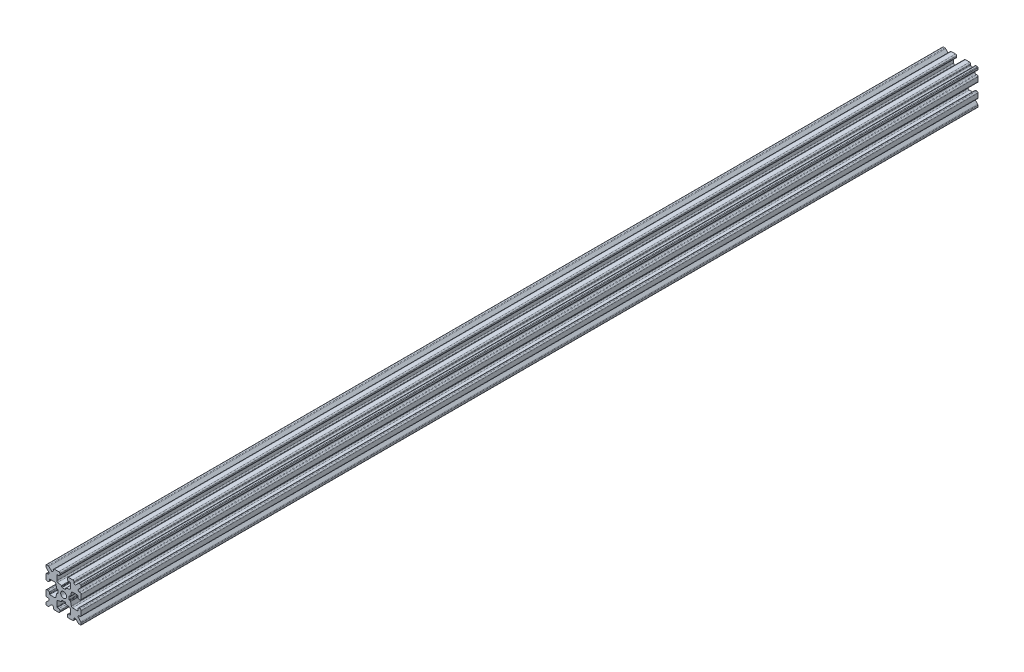
from build123d import *

# Parameters (mm, degrees)
SKETCH1_W           = 15
SKETCH1_H           = 15
SKETCH1_R           = 1.25
BOSS_EXTRUDE1_DEPTH = 191
FILLET1_R           = 0.25
CUT_EXTRUDE1_DEPTH  = 383.147222939
CUT_EXTRUDE3_DEPTH  = 383.147222939
FILLET3_R           = 0.5
FILLET4_R           = 0.5
FILLET5_R           = 3
FILLET6_R           = 0.2
CUT_EXTRUDE4_DEPTH  = 383.147222939
FILLET8_R           = 0.5
SKETCH6_W           = 5.1529354
SKETCH6_H           = 1.651
SKETCH6_W_2         = 1.651
SKETCH6_H_2         = 5.1529354
CUT_EXTRUDE5_DEPTH  = 383.147222939
FILLET10_R          = 0.2


with BuildPart() as part:
    # Sketch1 → Boss-Extrude1 (new, symmetric)
    with BuildSketch(Plane.XY):
        Rectangle(SKETCH1_W, SKETCH1_H)
        Circle(SKETCH1_R, mode=Mode.SUBTRACT)
    extrude(amount=BOSS_EXTRUDE1_DEPTH, both=True)

    # Fillet1
    fillet1_edges = [part.edges().sort_by_distance(p)[0] for p in [
        (7.5, -7.5, 0),
        (-7.5, -7.5, 0),
        (-7.5, 7.5, 0),
        (7.5, 7.5, 0),
    ]]
    fillet(fillet1_edges, radius=FILLET1_R)

    # Sketch2 → Cut-Extrude1 (cut, through all)
    with BuildSketch(Plane.XY.offset(191)):
        Polygon((-7.5, 1.6), (-6.1, 1.6), (-6.1, 2.9), (-3.4, 2.9), (-3.4, -2.9), (-6.1, -2.9), (-6.1, -1.6), (-7.5, -1.6), align=None)
        Polygon((2.9, 6.1), (1.6, 6.1), (1.6, 7.5), (-1.6, 7.5), (-1.6, 6.1), (-2.9, 6.1), (-2.9, 3.4), (2.9, 3.4), align=None)
        Polygon((-1.6, -7.5), (-1.6, -6.1), (-2.9, -6.1), (-2.9, -3.4), (2.9, -3.4), (2.9, -6.1), (1.6, -6.1), (1.6, -7.5), align=None)
        Polygon((6.1, -2.9), (6.1, -1.6), (7.5, -1.6), (7.5, 1.6), (6.1, 1.6), (6.1, 2.9), (3.4, 2.9), (3.4, -2.9), align=None)
    extrude(amount=-CUT_EXTRUDE1_DEPTH, mode=Mode.SUBTRACT)

    # Sketch4 → Cut-Extrude3 (cut, through all)
    with BuildSketch(Plane.XY.offset(191)):
        Polygon((-3.4, 2.9), (-2.75, 0), (-3.4, -2.9), align=None)
        Polygon((-2.9, 3.4), (0, 2.75), (2.9, 3.4), align=None)
        Polygon((3.4, 2.9), (2.75, 0), (3.4, -2.9), align=None)
        Polygon((-2.9, -3.4), (0, -2.75), (2.9, -3.4), align=None)
    extrude(amount=-CUT_EXTRUDE3_DEPTH, mode=Mode.SUBTRACT)

    # Fillet3
    fillet3_edges = [part.edges().sort_by_distance(p)[0] for p in [
        (1.6, -7.5, 0),
        (-1.6, -7.5, 0),
        (-1.6, -6.1, 0),
        (1.6, -6.1, 0),
        (6.1, 1.6, 0),
        (7.5, 1.6, 0),
        (7.5, -1.6, 0),
        (6.1, -1.6, 0),
        (-7.5, -1.6, 0),
        (-7.5, 1.6, 0),
        (-6.1, 1.6, 0),
        (-6.1, -1.6, 0),
        (-1.6, 6.1, 0),
        (-1.6, 7.5, 0),
        (1.6, 7.5, 0),
        (1.6, 6.1, 0),
    ]]
    fillet(fillet3_edges, radius=FILLET3_R)

    # Fillet4
    fillet4_edges = [part.edges().sort_by_distance(p)[0] for p in [
        (-2.9, -3.4, 0),
        (2.9, -3.4, 0),
        (3.4, -2.9, 0),
        (3.4, 2.9, 0),
        (-3.4, 2.9, 0),
        (-3.4, -2.9, 0),
        (2.9, 3.4, 0),
        (-2.9, 3.4, 0),
    ]]
    fillet(fillet4_edges, radius=FILLET4_R)

    # Fillet5
    fillet5_edges = [part.edges().sort_by_distance(p)[0] for p in [
        (-2.75, 0, 0),
        (0, 2.75, 0),
        (2.75, 0, 0),
        (0, -2.75, 0),
    ]]
    fillet(fillet5_edges, radius=FILLET5_R)

    # Fillet6
    fillet6_edges = [part.edges().sort_by_distance(p)[0] for p in [
        (-2.9, -6.1, 0),
        (2.9, -6.1, 0),
        (6.1, -2.9, 0),
        (6.1, 2.9, 0),
        (-6.1, 2.9, 0),
        (-6.1, -2.9, 0),
        (2.9, 6.1, 0),
        (-2.9, 6.1, 0),
    ]]
    fillet(fillet6_edges, radius=FILLET6_R)

    # Sketch5 → Cut-Extrude4 (cut, through all)
    with BuildSketch(Plane.XY.offset(191)):
        Polygon((-7.5, 6.439339828), (-5.460660172, 4.4), (-7.5, 4.4), align=None)
        Polygon((-6.439339828, 7.5), (-4.4, 5.460660172), (-4.4, 7.5), align=None)
        Polygon((4.4, 7.5), (6.439339828, 7.5), (4.4, 5.460660172), align=None)
        Polygon((7.5, 6.439339828), (7.5, 4.4), (5.460660172, 4.4), align=None)
        Polygon((7.5, -6.439339828), (5.460660172, -4.4), (7.5, -4.4), align=None)
        Polygon((6.439339828, -7.5), (4.4, -5.460660172), (4.4, -7.5), align=None)
        Polygon((-4.4, -7.5), (-6.439339828, -7.5), (-4.4, -5.460660172), align=None)
        Polygon((-7.5, -6.439339828), (-7.5, -4.4), (-5.460660172, -4.4), align=None)
    extrude(amount=-CUT_EXTRUDE4_DEPTH, mode=Mode.SUBTRACT)

    # Fillet8
    fillet8_edges = [part.edges().sort_by_distance(p)[0] for p in [
        (-7.5, 4.4, 0),
        (-7.5, 6.439339828, 0),
        (-5.460660172, 4.4, 0),
        (7.5, -4.4, 0),
        (7.5, -6.439339828, 0),
        (5.460660172, -4.4, 0),
        (5.460660172, 4.4, 0),
        (7.5, 6.439339828, 0),
        (7.5, 4.4, 0),
        (-4.4, 7.5, 0),
        (-4.4, 5.460660172, 0),
        (-6.439339828, 7.5, 0),
        (-5.460660172, -4.4, 0),
        (-7.5, -6.439339828, 0),
        (-7.5, -4.4, 0),
        (4.4, 5.460660172, 0),
        (4.4, 7.5, 0),
        (6.439339828, 7.5, 0),
        (6.439339828, -7.5, 0),
        (4.4, -7.5, 0),
        (4.4, -5.460660172, 0),
        (-6.439339828, -7.5, 0),
        (-4.4, -5.460660172, 0),
        (-4.4, -7.5, 0),
    ]]
    fillet(fillet8_edges, radius=FILLET8_R)

    # Sketch6 → Cut-Extrude5 (cut, through all)
    with BuildSketch(Plane.XY.offset(191)):
        with Locations((4.9235323, 0)):
            Rectangle(SKETCH6_W, SKETCH6_H)
        with Locations((0, -4.9235323)):
            Rectangle(SKETCH6_W_2, SKETCH6_H_2)
        with Locations((-4.9235323, 0)):
            Rectangle(SKETCH6_W, SKETCH6_H)
        with Locations((0, 4.9235323)):
            Rectangle(SKETCH6_W_2, SKETCH6_H_2)
    extrude(amount=-CUT_EXTRUDE5_DEPTH, mode=Mode.SUBTRACT)

    # Fillet10
    fillet10_edges = [part.edges().sort_by_distance(p)[0] for p in [
        (0.8255, -2.935025862, 0),
        (-0.8255, -2.935025862, 0),
        (0.8255, -2.3470646, 0),
        (-0.8255, -2.3470646, 0),
        (2.935025862, 0.8255, 0),
        (2.935025862, -0.8255, 0),
        (2.3470646, 0.8255, 0),
        (2.3470646, -0.8255, 0),
        (-2.935025862, -0.8255, 0),
        (-2.935025862, 0.8255, 0),
        (-2.3470646, -0.8255, 0),
        (-2.3470646, 0.8255, 0),
        (-0.8255, 2.935025862, 0),
        (0.8255, 2.935025862, 0),
        (-0.8255, 2.3470646, 0),
        (0.8255, 2.3470646, 0),
    ]]
    fillet(fillet10_edges, radius=FILLET10_R)


solid = part.part
